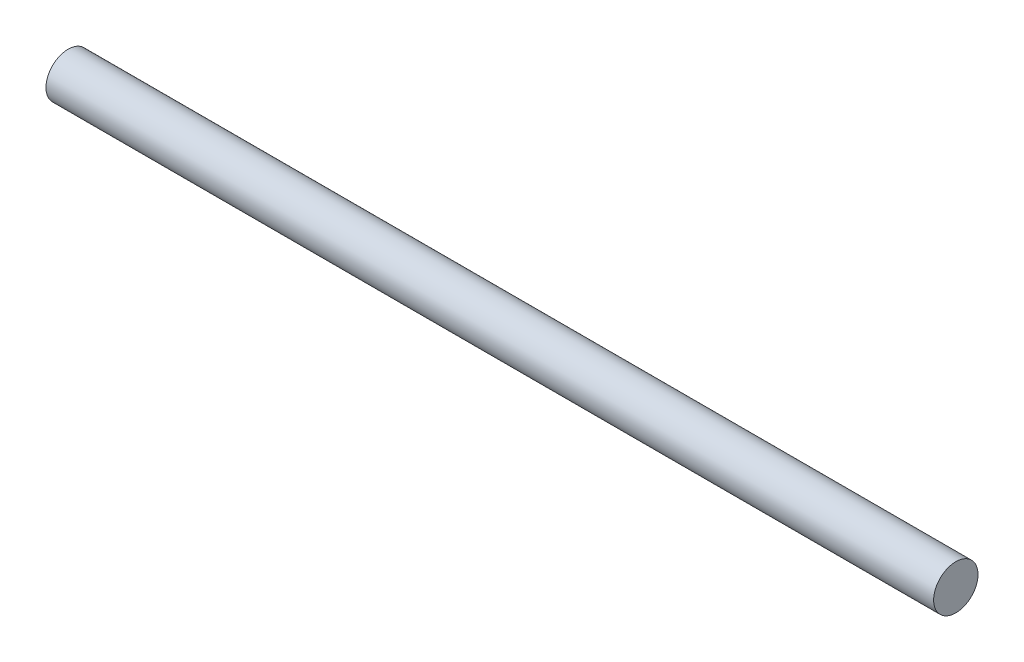
from build123d import *

# Parameters (mm, degrees)
SKETCH1_R           = 2
BOSS_EXTRUDE1_DEPTH = 80


with BuildPart() as part:
    # Sketch1 → Boss-Extrude1 (new body)
    with BuildSketch(Plane(origin=(0, 0, 0), x_dir=(0, 0, -1), z_dir=(1, 0, 0))):
        Circle(SKETCH1_R)
    extrude(amount=BOSS_EXTRUDE1_DEPTH)


solid = part.part
